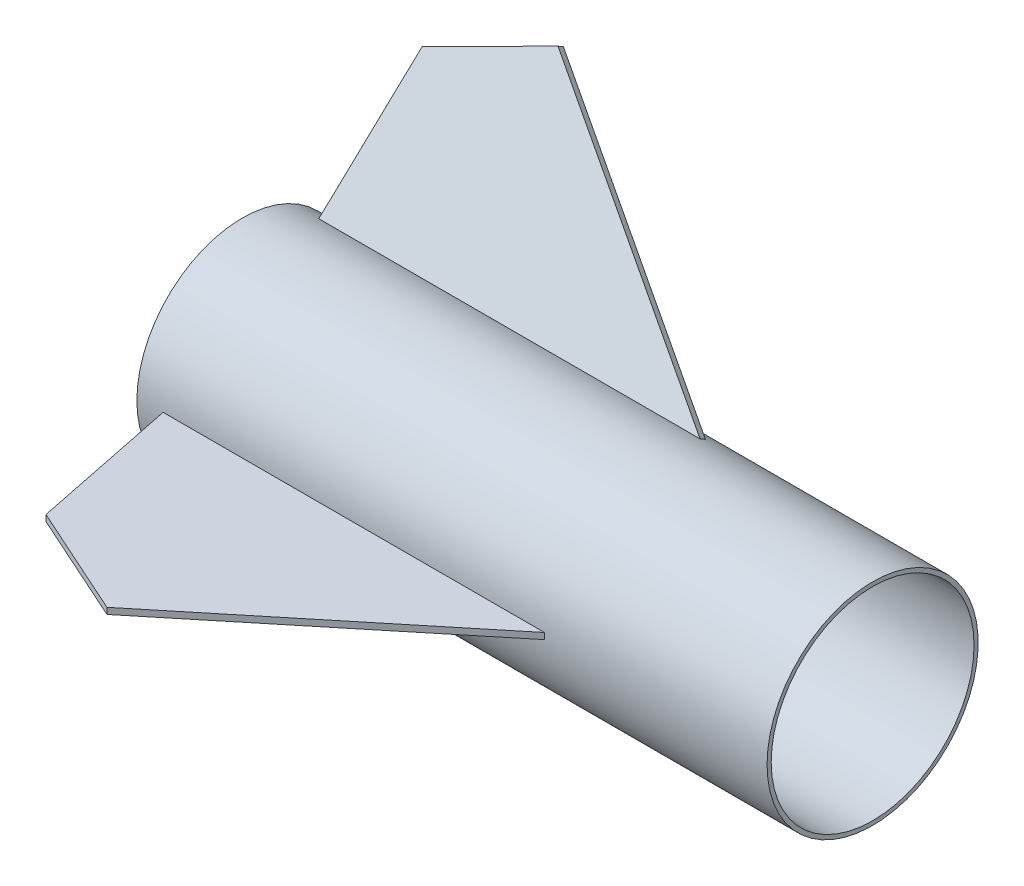
from build123d import *

# Parameters (mm, degrees)
BODY_TUBE_R              = 51.054
BODY_TUBE_R_2            = 49.0601
BOSS_EXTRUDE1_DEPTH      = 304.8
BOSS_EXTRUDE3_DEPTH      = 1.5
BOSS_EXTRUDE3_DEPTH_BACK = 1.5
CIRPATTERN10_COUNT       = 3


with BuildPart() as part:
    # Body Tube → Boss-Extrude1 (new body)
    with BuildSketch(Plane.YZ):
        Circle(BODY_TUBE_R)
        Circle(BODY_TUBE_R_2, mode=Mode.SUBTRACT)
    extrude(amount=BOSS_EXTRUDE1_DEPTH)


with BuildPart() as body_2:
    # Sketch6 → Boss-Extrude3 (new, two sides: drawn at the far end of the back side and taken through both)
    with BuildSketch(Plane(origin=(0, 0, 0), x_dir=(-1, 0, 0), z_dir=(0, 1, 0)).offset(-BOSS_EXTRUDE3_DEPTH_BACK)):
        Polygon((-12.7, 51.054), (-197.104, 51.054), (-80.772, 146.304), (-27.178, 122.174), align=None)
    extrude(amount=BOSS_EXTRUDE3_DEPTH + BOSS_EXTRUDE3_DEPTH_BACK)


with BuildPart() as cirpattern10_1:
    # CirPattern10: pattern copy
    add(body_2.part.rotate(Axis((304.8, 0, 0), (-1, 0, 0)), 1 * 360 / CIRPATTERN10_COUNT))


with BuildPart() as cirpattern10_2:
    # CirPattern10: pattern copy
    add(body_2.part.rotate(Axis((304.8, 0, 0), (-1, 0, 0)), 2 * 360 / CIRPATTERN10_COUNT))


solid = Compound([part.part, body_2.part, cirpattern10_1.part, cirpattern10_2.part])
